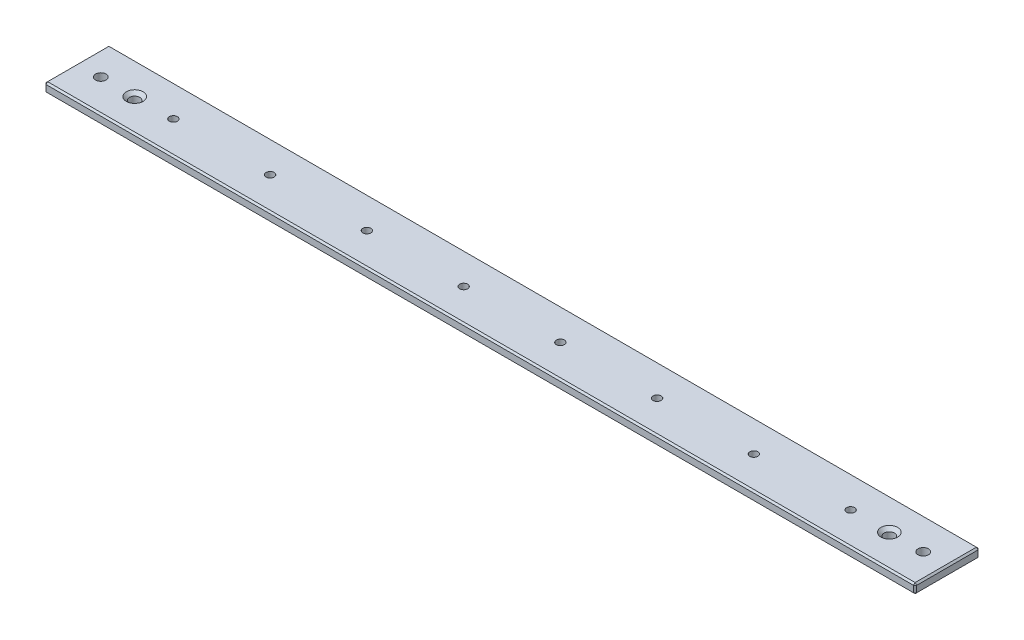
from build123d import *

# Parameters (mm, degrees)
SKETCH1_W           = 270
SKETCH1_H           = 20
BOSS_EXTRUDE1_DEPTH = 3
M3_TAPPED_HOLE1_D   = 2.5
SKETCH4_R           = 1.625
CUT_EXTRUDE1_DEPTH  = 136.403101885
CHAMFER1_SIZE       = 0.5
SKETCH5_R           = 1.6
CUT_EXTRUDE2_DEPTH  = 136.403101885
CHAMFER2_SIZE       = 1


with BuildPart() as part:
    # Sketch1 → Boss-Extrude1 (new body)
    with BuildSketch(Plane(origin=(0, 0, 0), x_dir=(1, 0, 0), z_dir=(0, 1, 0))):
        Rectangle(SKETCH1_W, SKETCH1_H)
    extrude(amount=BOSS_EXTRUDE1_DEPTH)

    # M3 Tapped Hole1 (through all)
    with Locations(Plane(origin=(-105, 3, 0), x_dir=(0, 0, 1), z_dir=(0, 1, 0))):
        with Locations((0, 0), (0, 30), (0, 60), (0, 90), (0, 120), (0, 150), (0, 180), (0, 210)):
            Hole(M3_TAPPED_HOLE1_D / 2)

    # Sketch4 → Cut-Extrude1 (cut, through all)
    with BuildSketch(Plane(origin=(0, 3, 0), x_dir=(1, 0, 0), z_dir=(0, 1, 0))):
        with Locations(Location((-127.5, 0, 0), (0, 0, 270))):
            Circle(SKETCH4_R)
        with Locations(Location((127.5, 0, 0), (0, 0, 270))):
            Circle(SKETCH4_R)
    extrude(amount=-CUT_EXTRUDE1_DEPTH, mode=Mode.SUBTRACT)

    # Chamfer1
    chamfer1_edges = [part.edges().sort_by_distance(p)[0] for p in [
        (-135, 3, 0),
        (0, 3, 10),
        (135, 3, 0),
        (0, 0, 10),
        (-135, 0, 0),
        (0, 0, -10),
        (135, 0, 0),
        (135, 1.5, 10),
        (-135, 1.5, 10),
        (-135, 1.5, -10),
        (135, 1.5, -10),
        (0, 3, -10),
    ]]
    chamfer(chamfer1_edges, length=CHAMFER1_SIZE)

    # Sketch5 → Cut-Extrude2 (cut, through all)
    with BuildSketch(Plane(origin=(0, 3, 0), x_dir=(1, 0, 0), z_dir=(0, 1, 0))):
        with Locations(Location((-117, 0, 0), (0, 0, 270))):
            Circle(SKETCH5_R)
        with Locations(Location((117, 0, 0), (0, 0, 270))):
            Circle(SKETCH5_R)
    extrude(amount=-CUT_EXTRUDE2_DEPTH, mode=Mode.SUBTRACT)

    # Chamfer2
    chamfer2_edges = [part.edges().sort_by_distance(p)[0] for p in [
        (-117, 3, -1.6),
        (117, 3, -1.6),
    ]]
    chamfer(chamfer2_edges, length=CHAMFER2_SIZE)


solid = part.part
